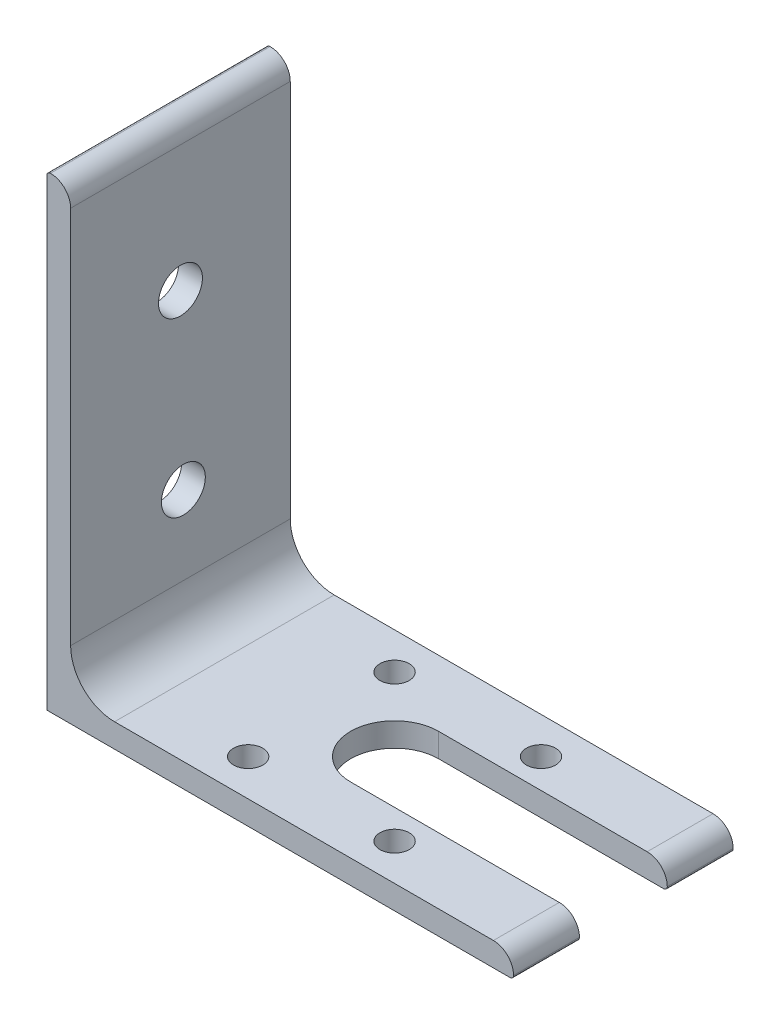
from build123d import *

# Parameters (mm, degrees)
BOSS_EXTRUDE1_DEPTH          = 30
F_4_0_4_DIAMETER_HOLE1_D     = 4
F_4_0_4_DIAMETER_HOLE1_DEPTH = 10
F_4_0_4_DIAMETER_HOLE1_TIP   = 1.201721238
CUT_EXTRUDE1_DEPTH           = 93.867176656
F_6_0_6_DIAMETER_HOLE1_D     = 6
F_6_0_6_DIAMETER_HOLE1_DEPTH = 10
F_6_0_6_DIAMETER_HOLE1_TIP   = 1.802581857


with BuildPart() as part:
    # Sketch2 → Boss-Extrude1 (new body)
    with BuildSketch(Plane.XY):
        with BuildLine():
            Line((0, 0), (63.26, 0))
            ThreePointArc((63.26, 0), (63.606482323, 0.143517677), (63.75, 0.49))
            Line((63.75, 0.49), (63.75, 0.5))
            ThreePointArc((63.75, 0.5), (62.944543648, 2.444543648), (61, 3.25))
            Line((61, 3.25), (9.25, 3.25))
            ThreePointArc((9.25, 3.25), (5.007359313, 5.007359313), (3.25, 9.25))
            Line((3.25, 9.25), (3.25, 61))
            ThreePointArc((3.25, 61), (2.444543648, 62.944543648), (0.5, 63.75))
            Line((0.5, 63.75), (0.49, 63.75))
            ThreePointArc((0.49, 63.75), (0.143517677, 63.606482323), (0, 63.26))
            Line((0, 63.26), (0, 0))
        make_face()
    extrude(amount=-BOSS_EXTRUDE1_DEPTH)

    # Ø4.0 (4) Diameter Hole1
    with Locations(Plane(origin=(0, 3.25, 0), x_dir=(1, 0, 0), z_dir=(0, 1, 0))):
        with Locations((22.5, 5), (22.5, 25), (42.5, 25), (42.5, 5)):
            Hole(F_4_0_4_DIAMETER_HOLE1_D / 2, depth=F_4_0_4_DIAMETER_HOLE1_DEPTH)
            with Locations((0, 0, -(F_4_0_4_DIAMETER_HOLE1_DEPTH + F_4_0_4_DIAMETER_HOLE1_TIP / 2))):  # 118° drill point
                Cone(0, F_4_0_4_DIAMETER_HOLE1_D / 2, F_4_0_4_DIAMETER_HOLE1_TIP, mode=Mode.SUBTRACT)

    # Sketch6 → Cut-Extrude1 (cut, through all)
    with BuildSketch(Plane(origin=(0, 3.25, 0), x_dir=(1, 0, 0), z_dir=(0, 1, 0))):
        with BuildLine():
            Line((32.5, 9), (66.86726804, 9))
            Line((66.86726804, 9), (66.86726804, 21))
            Line((66.86726804, 21), (32.5, 21))
            ThreePointArc((32.5, 21), (26.5, 15), (32.5, 9))
        make_face()
    extrude(amount=-CUT_EXTRUDE1_DEPTH, mode=Mode.SUBTRACT)

    # Ø6.0 (6) Diameter Hole1
    with Locations(Plane(origin=(3.25, 0, 0), x_dir=(0, 0, -1), z_dir=(1, 0, 0))):
        with Locations((15, 43.75), (15.399206183, 20)):
            Hole(F_6_0_6_DIAMETER_HOLE1_D / 2, depth=F_6_0_6_DIAMETER_HOLE1_DEPTH)
            with Locations((0, 0, -(F_6_0_6_DIAMETER_HOLE1_DEPTH + F_6_0_6_DIAMETER_HOLE1_TIP / 2))):  # 118° drill point
                Cone(0, F_6_0_6_DIAMETER_HOLE1_D / 2, F_6_0_6_DIAMETER_HOLE1_TIP, mode=Mode.SUBTRACT)


solid = part.part
